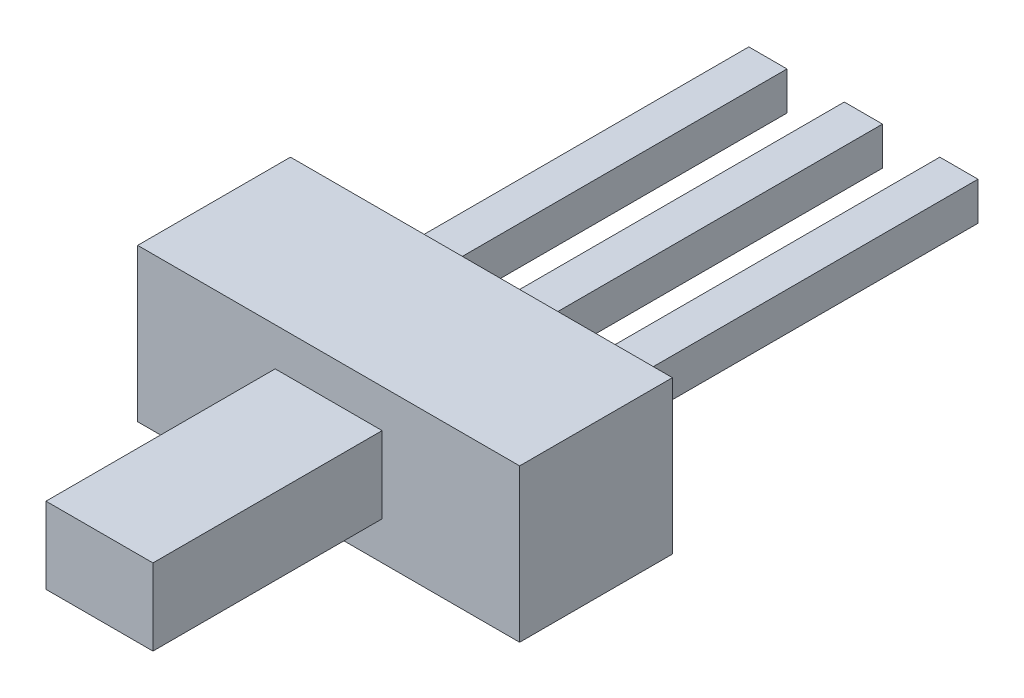
from build123d import *

# Parameters (mm, degrees)
SKETCH_1_W      = 5
SKETCH_1_H      = 2
EXTRUDE_1_DEPTH = 2
SKETCH_2_W      = 0.5
SKETCH_2_H      = 0.5
EXTRUDE_2_DEPTH = 5
SKETCH_3_W      = 1.4
SKETCH_3_H      = 1
EXTRUDE_3_DEPTH = 3


with BuildPart() as part:
    # Эскиз1 → Бобышка-Вытянуть1 (new body)
    with BuildSketch(Plane.XY):
        with Locations((2.5, -1)):
            Rectangle(SKETCH_1_W, SKETCH_1_H)
    extrude(amount=EXTRUDE_1_DEPTH)

    # Эскиз2 → Бобышка-Вытянуть2 (add)
    with BuildSketch(Plane(origin=(0, 0, 0), x_dir=(-1, 0, 0), z_dir=(0, 0, -1))):
        with Locations((-1.25, -1)):
            Rectangle(SKETCH_2_W, SKETCH_2_H)
        with Locations((-2.5, -1)):
            Rectangle(SKETCH_2_W, SKETCH_2_H)
        with Locations((-3.75, -1)):
            Rectangle(SKETCH_2_W, SKETCH_2_H)
    extrude(amount=EXTRUDE_2_DEPTH)

    # Эскиз3 → Бобышка-Вытянуть3 (add)
    with BuildSketch(Plane.XY.offset(2)):
        with Locations((2.5, -1)):
            Rectangle(SKETCH_3_W, SKETCH_3_H)
    extrude(amount=EXTRUDE_3_DEPTH)


solid = part.part
